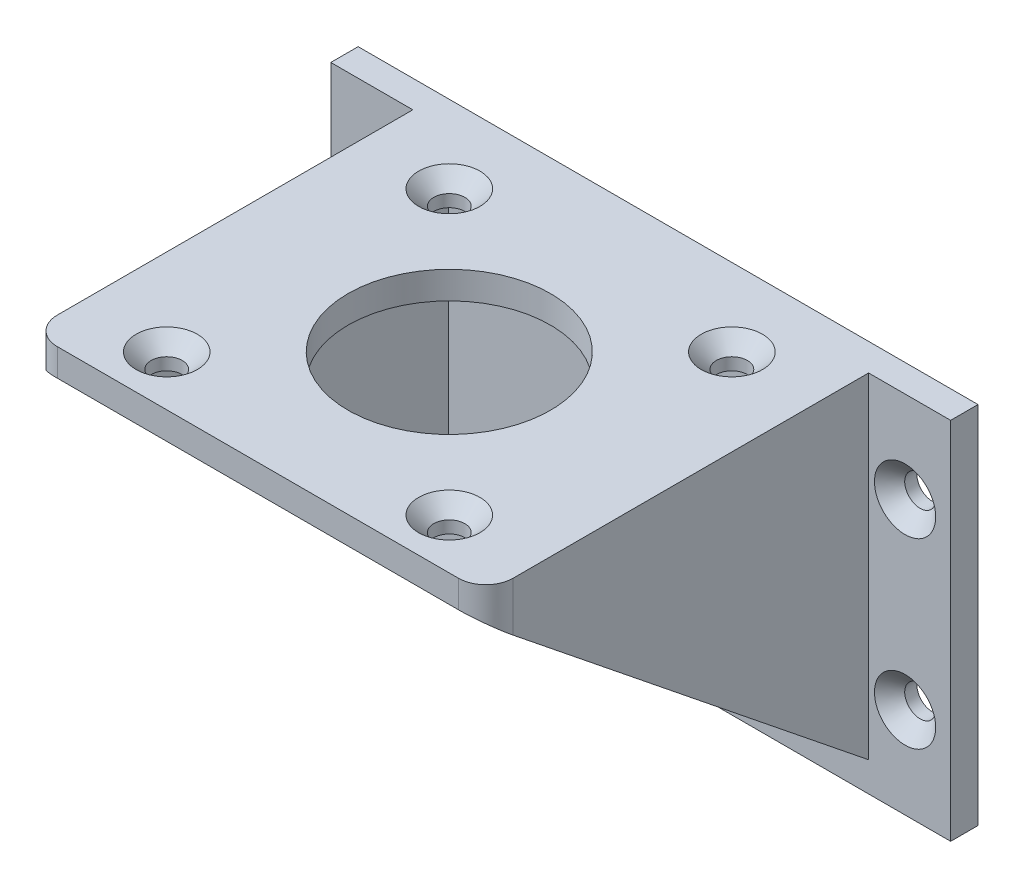
from build123d import *

# Parameters (mm, degrees)
SKETCH1_W                    = 68
SKETCH1_H                    = 40
BOSS_EXTRUDE1_DEPTH          = 3
SKETCH3_W                    = 50
SKETCH3_H                    = 42
BOSS_EXTRUDE2_DEPTH          = 3
CUT_EXTRUDE1_REACH           = 71.145
SKETCH4_R                    = 11.1
CSK_FOR_M3_SFHCS1_AT_2_COUNT = 2
CSK_FOR_M3_SFHCS1_AT_2_PITCH = 31
CSK_FOR_M3_SFHCS1_AT_3_COUNT = 2
CSK_FOR_M3_SFHCS1_AT_3_PITCH = 31
CSK_FOR_M3_SFHCS1_AT_4_COUNT = 2
CSK_FOR_M3_SFHCS1_AT_4_PITCH = 43.840620434
BOSS_EXTRUDE3_DEPTH          = 50
SKETCH9_W                    = 42.2
SKETCH9_H                    = 42
CUT_EXTRUDE2_DEPTH           = 37
FILLET1_R                    = 3
CSK_FOR_M3_SFHCS2_AT_2_COUNT = 2
CSK_FOR_M3_SFHCS2_AT_2_PITCH = 61.351446601
CSK_FOR_M3_SFHCS2_AT_3_COUNT = 2
CSK_FOR_M3_SFHCS2_AT_3_PITCH = 20
CSK_FOR_M3_SFHCS2_AT_4_COUNT = 2
CSK_FOR_M3_SFHCS2_AT_4_PITCH = 58


with BuildPart() as part:
    # Sketch1 → Boss-Extrude1 (new body)
    with BuildSketch(Plane.XY):
        with Locations((0, -20)):
            Rectangle(SKETCH1_W, SKETCH1_H)
    extrude(amount=BOSS_EXTRUDE1_DEPTH)

    # Sketch3 → Boss-Extrude2 (add)
    with BuildSketch(Plane(origin=(0, 0, 0), x_dir=(1, 0, 0), z_dir=(0, 1, 0))):
        with Locations((0, -24)):
            Rectangle(SKETCH3_W, SKETCH3_H)
    extrude(amount=-BOSS_EXTRUDE2_DEPTH)

    # Sketch4 → Cut-Extrude1 (cut, up to next)
    with BuildSketch(Plane(origin=(0, 0, 0), x_dir=(1, 0, 0), z_dir=(0, 1, 0)), mode=Mode.PRIVATE) as cut_extrude1_sk1:
        with Locations(Location((0, -24, 0), (0, 0, 180))):
            Circle(SKETCH4_R)
    cut_extrude1_tool1 = extrude(cut_extrude1_sk1.sketch, amount=-CUT_EXTRUDE1_REACH, mode=Mode.PRIVATE) & part.part
    add(cut_extrude1_tool1.solids().sort_by_distance((0, 0, 24))[0], mode=Mode.SUBTRACT)

    # Sketch6 → CSK for M3 SFHCS1 (revolve, cut)
    with BuildSketch(Plane(origin=(-15.5, 0, 8.5), x_dir=(0, 0, 1), z_dir=(1, 0, 0))):
        Polygon((0, 0), (0, 3), (1.7, 3), (1.7, 1.66), (3.36, 0), align=None)
    csk_for_m3_sfhcs1 = revolve(axis=Axis((-15.5, 6.35, 8.5), (0, -1, 0)), mode=Mode.SUBTRACT)

    # CSK for M3 SFHCS1 at 2: CSK for M3 SFHCS1 ×2
    with Locations(*[(i * CSK_FOR_M3_SFHCS1_AT_2_PITCH, 0, 0) for i in range(1, CSK_FOR_M3_SFHCS1_AT_2_COUNT)]):
        add(csk_for_m3_sfhcs1, mode=Mode.SUBTRACT)

    # CSK for M3 SFHCS1 at 3: CSK for M3 SFHCS1 ×2
    with Locations(*[(0, 0, i * CSK_FOR_M3_SFHCS1_AT_3_PITCH) for i in range(1, CSK_FOR_M3_SFHCS1_AT_3_COUNT)]):
        add(csk_for_m3_sfhcs1, mode=Mode.SUBTRACT)

    # CSK for M3 SFHCS1 at 4: CSK for M3 SFHCS1 ×2
    with Locations(*[Vector(0.7071067811865476, 0, 0.7071067811865476) * (i * CSK_FOR_M3_SFHCS1_AT_4_PITCH) for i in range(1, CSK_FOR_M3_SFHCS1_AT_4_COUNT)]):
        add(csk_for_m3_sfhcs1, mode=Mode.SUBTRACT)

    # Sketch7 → Boss-Extrude3 (add)
    with BuildSketch(Plane.ZY.offset(25)):
        Polygon((45, -3), (3, -36.75), (3, -3), align=None)
    extrude(amount=-BOSS_EXTRUDE3_DEPTH)

    # Sketch9 → Cut-Extrude2 (cut)
    with BuildSketch(Plane.XZ.offset(40)):
        with Locations((0, 24)):
            Rectangle(SKETCH9_W, SKETCH9_H)
    extrude(amount=-CUT_EXTRUDE2_DEPTH, mode=Mode.SUBTRACT)

    # Fillet1
    fillet1_edges = [part.edges().sort_by_distance(p)[0] for p in [
        (-25, -1.5, 45),
        (25, -1.5, 45),
    ]]
    fillet(fillet1_edges, radius=FILLET1_R)

    # Sketch11 → CSK for M3 SFHCS2 (revolve, cut)
    with BuildSketch(Plane(origin=(-29, -30, 3), x_dir=(0, -1, 0), z_dir=(1, 0, 0))):
        Polygon((0, 0), (0, 3), (1.7, 3), (1.7, 1.66), (3.36, 0), align=None)
    csk_for_m3_sfhcs2 = revolve(axis=Axis((-29, -30, 9.35), (0, 0, -1)), mode=Mode.SUBTRACT)

    # CSK for M3 SFHCS2 at 2: CSK for M3 SFHCS2 ×2
    with Locations(*[Vector(0.9453729816262721, 0.32599068331940423, 0) * (i * CSK_FOR_M3_SFHCS2_AT_2_PITCH) for i in range(1, CSK_FOR_M3_SFHCS2_AT_2_COUNT)]):
        add(csk_for_m3_sfhcs2, mode=Mode.SUBTRACT)

    # CSK for M3 SFHCS2 at 3: CSK for M3 SFHCS2 ×2
    with Locations(*[(0, i * CSK_FOR_M3_SFHCS2_AT_3_PITCH, 0) for i in range(1, CSK_FOR_M3_SFHCS2_AT_3_COUNT)]):
        add(csk_for_m3_sfhcs2, mode=Mode.SUBTRACT)

    # CSK for M3 SFHCS2 at 4: CSK for M3 SFHCS2 ×2
    with Locations(*[(i * CSK_FOR_M3_SFHCS2_AT_4_PITCH, 0, 0) for i in range(1, CSK_FOR_M3_SFHCS2_AT_4_COUNT)]):
        add(csk_for_m3_sfhcs2, mode=Mode.SUBTRACT)


solid = part.part
